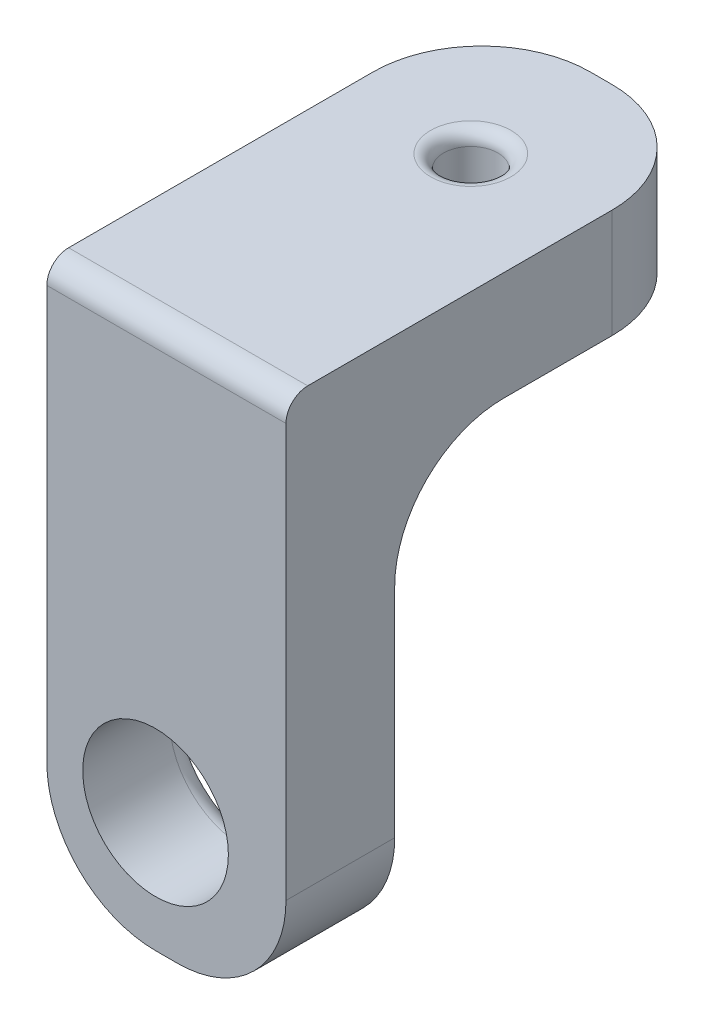
from build123d import *

# Parameters (mm, degrees)
SKETCH_1_W          = 11
SKETCH_1_H          = 20
SKETCH_1_R          = 3.35
EXTRUDE_1_DEPTH     = 5
SKETCH_2_W          = 11
SKETCH_2_H          = 20
EXTRUDE_2_DEPTH     = 5
FILLET_1_R          = 5
FILLET_2_R          = 1
FILLET_4_R          = 1
FILLET_8_R          = 5
FILLET_9_R          = 5
CUT_EXTRUDE_3_DEPTH = 2
SKETCH_9_R          = 1.25
CUT_EXTRUDE_4_DEPTH = 3
FILLET_10_R         = 0.6


with BuildPart() as part:
    # Эскиз1 → Бобышка-Вытянуть1 (new body)
    with BuildSketch(Plane.XY):
        with Locations((0.5, 4.5)):
            Rectangle(SKETCH_1_W, SKETCH_1_H)
        Circle(SKETCH_1_R, mode=Mode.SUBTRACT)
    extrude(amount=EXTRUDE_1_DEPTH)

    # Эскиз2 → Бобышка-Вытянуть2 (add)
    with BuildSketch(Plane(origin=(0, 14.5, 0), x_dir=(1, 0, 0), z_dir=(0, 1, 0))):
        with Locations((0.5, 5)):
            Rectangle(SKETCH_2_W, SKETCH_2_H)
    extrude(amount=EXTRUDE_2_DEPTH)

    # Скругление1
    fillet_1_edges = [part.edges().sort_by_distance(p)[0] for p in [
        (0.5, 14.5, 0),
    ]]
    fillet(fillet_1_edges, radius=FILLET_1_R)

    # Скругление2
    fillet_2_edges = [part.edges().sort_by_distance(p)[0] for p in [
        (-3.35, 0, 0),
    ]]
    fillet(fillet_2_edges, radius=FILLET_2_R)

    # Скругление4
    fillet_4_edges = [part.edges().sort_by_distance(p)[0] for p in [
        (0.5, 19.5, 5),
    ]]
    fillet(fillet_4_edges, radius=FILLET_4_R)

    # Скругление8
    fillet_8_edges = [part.edges().sort_by_distance(p)[0] for p in [
        (6, -5.5, 2.5),
        (-5, -5.5, 2.5),
    ]]
    fillet(fillet_8_edges, radius=FILLET_8_R)

    # Скругление9
    fillet_9_edges = [part.edges().sort_by_distance(p)[0] for p in [
        (-5, 17, -15),
        (6, 17, -15),
    ]]
    fillet(fillet_9_edges, radius=FILLET_9_R)

    # Эскиз8 → Вырез-Вытянуть3 (cut)
    with BuildSketch(Plane.XZ.offset(-14.5)):
        Polygon((2.809401077, -9), (1.654700538, -7), (-0.654700538, -7), (-1.809401077, -9), (-0.654700538, -11), (1.654700538, -11), align=None)
    extrude(amount=-CUT_EXTRUDE_3_DEPTH, mode=Mode.SUBTRACT)

    # Эскиз9 → Вырез-Вытянуть4 (cut)
    with BuildSketch(Plane.XZ.offset(-16.5)):
        with Locations(Location((0.5, -9, 0), (0, 0, 270))):
            Circle(SKETCH_9_R)
    extrude(amount=-CUT_EXTRUDE_4_DEPTH, mode=Mode.SUBTRACT)

    # Скругление10
    fillet_10_edges = [part.edges().sort_by_distance(p)[0] for p in [
        (0.5, 19.5, -7.75),
    ]]
    fillet(fillet_10_edges, radius=FILLET_10_R)


solid = part.part
